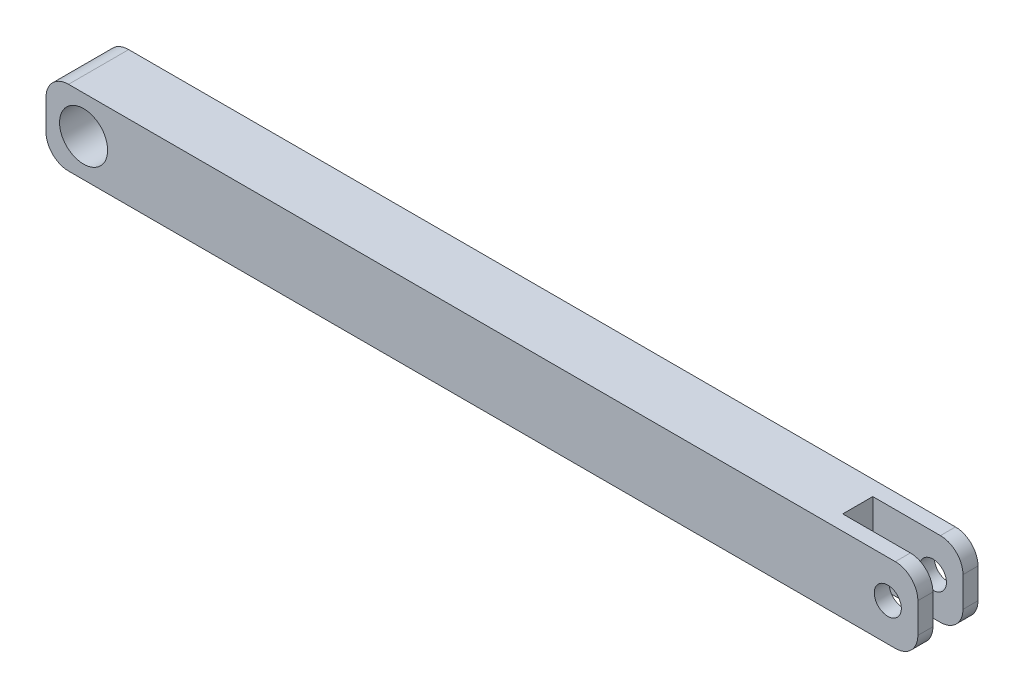
from build123d import *

# Parameters (mm, degrees)
SKETCH_5_W          = 58
SKETCH_5_H          = 3
EXTRUDE_1_DEPTH     = 5
CUT_EXTRUDE_1_REACH = 60.292
SKETCH_6_R          = 1.6
CUT_EXTRUDE_2_REACH = 60.292
SKETCH_7_R          = 0.9
FILLET_1_R          = 1.5
SKETCH_8_W          = 6
SKETCH_8_H          = 1.6
CUT_EXTRUDE_3_DEPTH = 10
SKETCH_10_R         = 1.6
SKETCH_10_R_2       = 0.9
EXTRUDE_2_DEPTH     = 0.5
EXTRUDE_START       = 0.5
SKETCH_11_R         = 0.9
SKETCH_11_R_2       = 1.6
EXTRUDE_3_DEPTH     = 0.5
SKETCH_12_W         = 6.44666191
SKETCH_12_H         = 2
CUT_EXTRUDE_4_DEPTH = 10


with BuildPart() as part:
    # 草图5 → 凸台-拉伸1 (new body)
    with BuildSketch(Plane(origin=(0, 0, 0), x_dir=(1, 0, 0), z_dir=(0, 1, 0))):
        with Locations((29, -1.5)):
            Rectangle(SKETCH_5_W, SKETCH_5_H)
    extrude(amount=EXTRUDE_1_DEPTH)

    # 草图6 → 切除-拉伸1 (cut, up to next)
    with BuildSketch(Plane.XY.offset(3), mode=Mode.PRIVATE) as cut_extrude_1_sk1:
        with Locations((2.5, 2.5)):
            Circle(SKETCH_6_R)
    cut_extrude_1_tool1 = extrude(cut_extrude_1_sk1.sketch, amount=-CUT_EXTRUDE_1_REACH, mode=Mode.PRIVATE) & part.part
    add(cut_extrude_1_tool1.solids().sort_by_distance((2.5, 2.5, 3))[0], mode=Mode.SUBTRACT)

    # 草图7 → 切除-拉伸2 (cut, up to next)
    with BuildSketch(Plane.XY, mode=Mode.PRIVATE) as cut_extrude_2_sk1:
        with Locations(Location((56, 2.5, 0), (0, 0, 180))):
            Circle(SKETCH_7_R)
    cut_extrude_2_tool1 = extrude(cut_extrude_2_sk1.sketch, amount=CUT_EXTRUDE_2_REACH, mode=Mode.PRIVATE) & part.part
    add(cut_extrude_2_tool1.solids().sort_by_distance((56, 2.5, 0))[0], mode=Mode.SUBTRACT)

    # 圆角1
    fillet_1_edges = [part.edges().sort_by_distance(p)[0] for p in [
        (58, 5, 1.5),
        (58, 0, 1.5),
        (0, 0, 1.5),
        (0, 5, 1.5),
    ]]
    fillet(fillet_1_edges, radius=FILLET_1_R)

    # 草图8 → 切除-拉伸3 (cut)
    with BuildSketch(Plane(origin=(0, 5, 0), x_dir=(1, 0, 0), z_dir=(0, 1, 0))):
        with Locations((55, -1.5)):
            Rectangle(SKETCH_8_W, SKETCH_8_H)
    extrude(amount=-CUT_EXTRUDE_3_DEPTH, mode=Mode.SUBTRACT)

    # 草图10 → 凸台-拉伸2 (add)
    with BuildSketch(Plane.XY.offset(3)):
        with BuildLine():
            Line((58, 1.5), (58, 3.5))
            ThreePointArc((58, 3.5), (57.560660172, 4.560660172), (56.5, 5))
            Line((56.5, 5), (1.5, 5))
            ThreePointArc((1.5, 5), (0.439339828, 4.560660172), (0, 3.5))
            Line((0, 3.5), (0, 1.5))
            ThreePointArc((0, 1.5), (0.439339828, 0.439339828), (1.5, 0))
            Line((1.5, 0), (56.5, 0))
            ThreePointArc((56.5, 0), (57.560660172, 0.439339828), (58, 1.5))
        make_face()
        with Locations((2.5, 2.5)):
            Circle(SKETCH_10_R, mode=Mode.SUBTRACT)
        with Locations(Location((56, 2.5, 0), (0, 0, 180))):
            Circle(SKETCH_10_R_2, mode=Mode.SUBTRACT)
    extrude(amount=EXTRUDE_2_DEPTH)

    # 草图11 → 凸台-拉伸3 (add)
    with BuildSketch(Plane(origin=(0, 0, 0), x_dir=(-1, 0, 0), z_dir=(0, 0, -1)).offset(EXTRUDE_START)):
        with BuildLine():
            Line((-1.5, 5), (-56.5, 5))
            ThreePointArc((-56.5, 5), (-57.560660172, 4.560660172), (-58, 3.5))
            Line((-58, 3.5), (-58, 1.5))
            ThreePointArc((-58, 1.5), (-57.560660172, 0.439339828), (-56.5, 0))
            Line((-56.5, 0), (-1.5, 0))
            ThreePointArc((-1.5, 0), (-0.439339828, 0.439339828), (0, 1.5))
            Line((0, 1.5), (0, 3.5))
            ThreePointArc((0, 3.5), (-0.439339828, 4.560660172), (-1.5, 5))
        make_face()
        with Locations((-56, 2.5)):
            Circle(SKETCH_11_R, mode=Mode.SUBTRACT)
        with Locations(Location((-2.5, 2.5, 0), (0, 0, 180))):
            Circle(SKETCH_11_R_2, mode=Mode.SUBTRACT)
    extrude(amount=-EXTRUDE_3_DEPTH)

    # 草图12 → 切除-拉伸4 (cut)
    with BuildSketch(Plane.XZ):
        with Locations((55.223330955, 1.5)):
            Rectangle(SKETCH_12_W, SKETCH_12_H)
    extrude(amount=-CUT_EXTRUDE_4_DEPTH, mode=Mode.SUBTRACT)


solid = part.part
